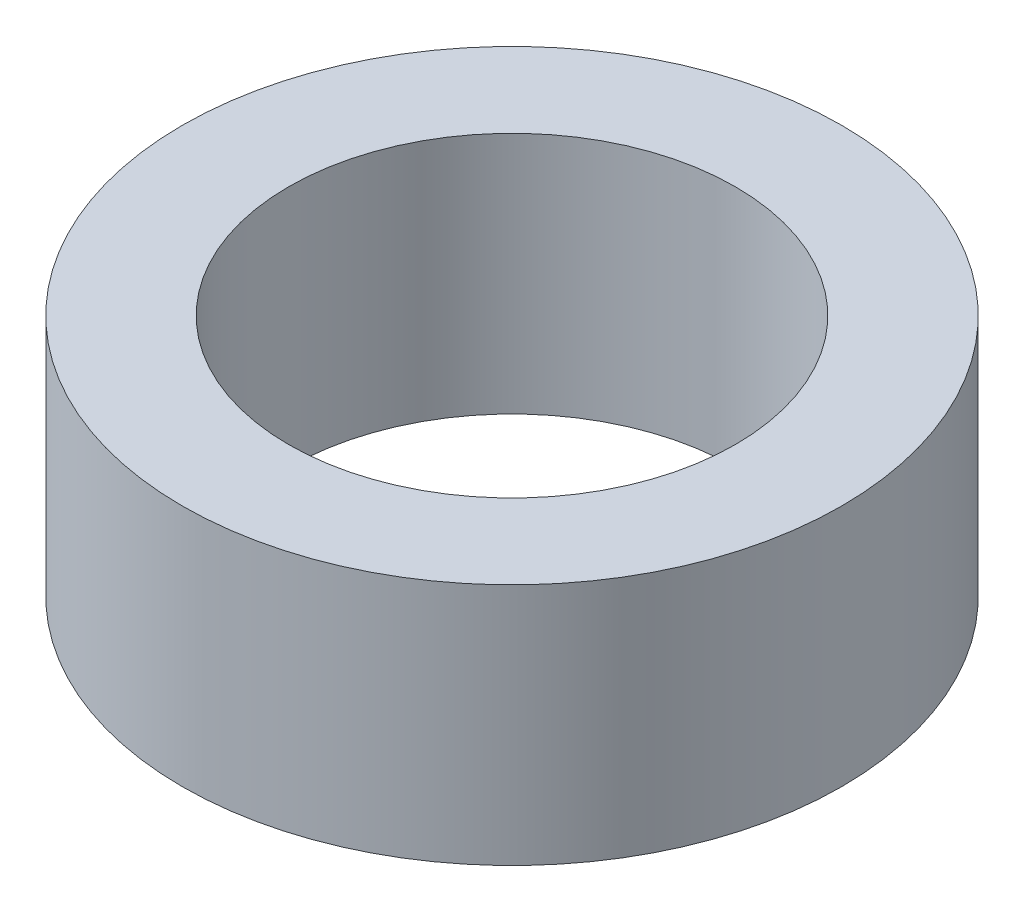
from build123d import *

# Parameters (mm, degrees)
SKETCH1_R           = 5.425
SKETCH1_R_2         = 3.675
BOSS_EXTRUDE1_DEPTH = 4


with BuildPart() as part:
    # Sketch1 → Boss-Extrude1 (new body)
    with BuildSketch(Plane(origin=(0, 0, 0), x_dir=(1, 0, 0), z_dir=(0, 1, 0))):
        with Locations(Location((0, 0, 0), (0, 0, 270))):
            Circle(SKETCH1_R)
        with Locations(Location((0, 0, 0), (0, 0, 270))):
            Circle(SKETCH1_R_2, mode=Mode.SUBTRACT)
    extrude(amount=BOSS_EXTRUDE1_DEPTH)


solid = part.part
